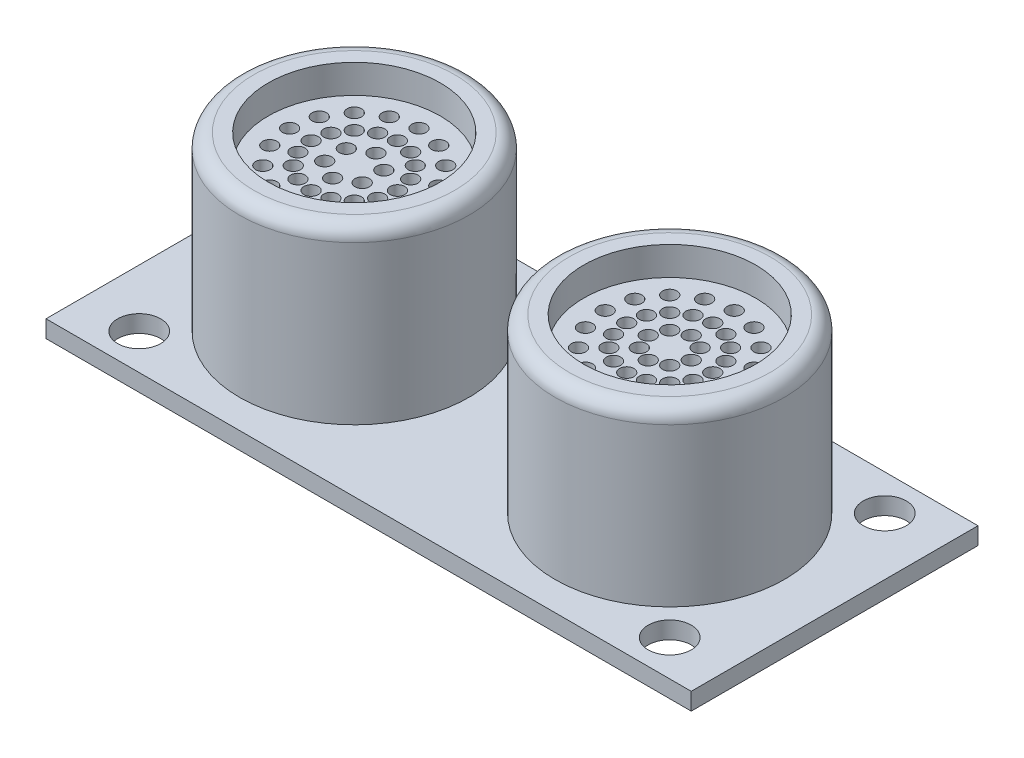
from build123d import *

# Parameters (mm, degrees)
SKETCH_1_W          = 45
SKETCH_1_H          = 20
EXTRUDE_1_DEPTH     = 1.2
SKETCH_2_R          = 8
SKETCH_2_R_2        = 6
EXTRUDE_2_DEPTH     = 12
FILLET_1_R          = 1
EXTRUDE_START       = -8
SKETCH_3_R          = 6
SKETCH_3_R_2        = 0.5
EXTRUDE_3_DEPTH     = 8
SKETCH_4_R          = 0.5
CUT_EXTRUDE_1_DEPTH = 8
SKETCH_5_R          = 1.5
CUT_EXTRUDE_2_DEPTH = 28.39069185


with BuildPart() as part:
    # 草图1 → 凸台-拉伸1 (new body)
    with BuildSketch(Plane(origin=(0, 0, 0), x_dir=(1, 0, 0), z_dir=(0, 1, 0))):
        Rectangle(SKETCH_1_W, SKETCH_1_H)
    extrude(amount=EXTRUDE_1_DEPTH)

    # 草图2 → 凸台-拉伸2 (add)
    # profile 1 of 2: a face of its own
    with BuildSketch(Plane(origin=(0, 1.2, 0), x_dir=(1, 0, 0), z_dir=(0, 1, 0))):
        with Locations(Location((-11, 0, 0), (0, 0, 270))):
            Circle(SKETCH_2_R)
        with Locations(Location((-11, 0, 0), (0, 0, 270))):
            Circle(SKETCH_2_R_2, mode=Mode.SUBTRACT)
    # profile 2 of 2: a face of its own
    with BuildSketch(Plane(origin=(0, 1.2, 0), x_dir=(1, 0, 0), z_dir=(0, 1, 0))):
        with Locations(Location((11, 0, 0), (0, 0, 270))):
            Circle(SKETCH_2_R)
        with Locations(Location((11, 0, 0), (0, 0, 270))):
            Circle(SKETCH_2_R_2, mode=Mode.SUBTRACT)
    extrude(amount=EXTRUDE_2_DEPTH)

    # 圆角1
    fillet_1_edges = [part.edges().sort_by_distance(p)[0] for p in [
        (-11, 13.2, -8),
        (11, 13.2, -8),
    ]]
    fillet(fillet_1_edges, radius=FILLET_1_R)

    # 草图3 → 凸台-拉伸3 (add)
    # profile 1 of 2: a face of its own
    with BuildSketch(Plane(origin=(0, 11.2, 0), x_dir=(1, 0, 0), z_dir=(0, 1, 0)).offset(EXTRUDE_START)):
        with Locations(Location((-11, 0, 0), (0, 0, 270))):
            Circle(SKETCH_3_R)
        with Locations(Location((-11, 4.509880422, 0), (0, 0, 270))):
            Circle(SKETCH_3_R_2, mode=Mode.SUBTRACT)
        with Locations(Location((-11, 3.009880422, 0), (0, 0, 270))):
            Circle(SKETCH_3_R_2, mode=Mode.SUBTRACT)
        with Locations(Location((-11, 1.509880422, 0), (0, 0, 270))):
            Circle(SKETCH_3_R_2, mode=Mode.SUBTRACT)
        with Locations(Location((-9.27414348, 4.166586216, 0), (0, 0, 270))):
            Circle(SKETCH_3_R_2, mode=Mode.SUBTRACT)
        with Locations(Location((-9.848168629, 2.780766918, 0), (0, 0, 270))):
            Circle(SKETCH_3_R_2, mode=Mode.SUBTRACT)
        with Locations(Location((-7.811032971, 3.188967029, 0), (0, 0, 270))):
            Circle(SKETCH_3_R_2, mode=Mode.SUBTRACT)
        with Locations(Location((-8.871693143, 2.128306857, 0), (0, 0, 270))):
            Circle(SKETCH_3_R_2, mode=Mode.SUBTRACT)
        with Locations(Location((-6.833413784, 1.72585652, 0), (0, 0, 270))):
            Circle(SKETCH_3_R_2, mode=Mode.SUBTRACT)
        with Locations(Location((-8.219233082, 1.151831371, 0), (0, 0, 270))):
            Circle(SKETCH_3_R_2, mode=Mode.SUBTRACT)
        with Locations(Location((-6.490119578, 0, 0), (0, 0, 270))):
            Circle(SKETCH_3_R_2, mode=Mode.SUBTRACT)
        with Locations(Location((-7.990119578, 0, 0), (0, 0, 270))):
            Circle(SKETCH_3_R_2, mode=Mode.SUBTRACT)
        with Locations(Location((-6.833413784, -1.72585652, 0), (0, 0, 270))):
            Circle(SKETCH_3_R_2, mode=Mode.SUBTRACT)
        with Locations(Location((-8.219233082, -1.151831371, 0), (0, 0, 270))):
            Circle(SKETCH_3_R_2, mode=Mode.SUBTRACT)
        with Locations(Location((-7.811032971, -3.188967029, 0), (0, 0, 270))):
            Circle(SKETCH_3_R_2, mode=Mode.SUBTRACT)
        with Locations(Location((-8.871693143, -2.128306857, 0), (0, 0, 270))):
            Circle(SKETCH_3_R_2, mode=Mode.SUBTRACT)
        with Locations(Location((-9.27414348, -4.166586216, 0), (0, 0, 270))):
            Circle(SKETCH_3_R_2, mode=Mode.SUBTRACT)
        with Locations(Location((-9.848168629, -2.780766918, 0), (0, 0, 270))):
            Circle(SKETCH_3_R_2, mode=Mode.SUBTRACT)
        with Locations(Location((-11, -4.509880422, 0), (0, 0, 270))):
            Circle(SKETCH_3_R_2, mode=Mode.SUBTRACT)
        with Locations(Location((-11, -3.009880422, 0), (0, 0, 270))):
            Circle(SKETCH_3_R_2, mode=Mode.SUBTRACT)
        with Locations(Location((-12.72585652, -4.166586216, 0), (0, 0, 270))):
            Circle(SKETCH_3_R_2, mode=Mode.SUBTRACT)
        with Locations(Location((-12.151831371, -2.780766918, 0), (0, 0, 270))):
            Circle(SKETCH_3_R_2, mode=Mode.SUBTRACT)
        with Locations(Location((-14.188967029, -3.188967029, 0), (0, 0, 270))):
            Circle(SKETCH_3_R_2, mode=Mode.SUBTRACT)
        with Locations(Location((-13.128306857, -2.128306857, 0), (0, 0, 270))):
            Circle(SKETCH_3_R_2, mode=Mode.SUBTRACT)
        with Locations(Location((-15.166586216, -1.72585652, 0), (0, 0, 270))):
            Circle(SKETCH_3_R_2, mode=Mode.SUBTRACT)
        with Locations(Location((-13.780766918, -1.151831371, 0), (0, 0, 270))):
            Circle(SKETCH_3_R_2, mode=Mode.SUBTRACT)
        with Locations(Location((-15.509880422, 0, 0), (0, 0, 270))):
            Circle(SKETCH_3_R_2, mode=Mode.SUBTRACT)
        with Locations(Location((-14.009880422, 0, 0), (0, 0, 270))):
            Circle(SKETCH_3_R_2, mode=Mode.SUBTRACT)
        with Locations(Location((-15.166586216, 1.72585652, 0), (0, 0, 270))):
            Circle(SKETCH_3_R_2, mode=Mode.SUBTRACT)
        with Locations(Location((-13.780766918, 1.151831371, 0), (0, 0, 270))):
            Circle(SKETCH_3_R_2, mode=Mode.SUBTRACT)
        with Locations(Location((-14.188967029, 3.188967029, 0), (0, 0, 270))):
            Circle(SKETCH_3_R_2, mode=Mode.SUBTRACT)
        with Locations(Location((-13.128306857, 2.128306857, 0), (0, 0, 270))):
            Circle(SKETCH_3_R_2, mode=Mode.SUBTRACT)
        with Locations(Location((-12.72585652, 4.166586216, 0), (0, 0, 270))):
            Circle(SKETCH_3_R_2, mode=Mode.SUBTRACT)
        with Locations(Location((-12.151831371, 2.780766918, 0), (0, 0, 270))):
            Circle(SKETCH_3_R_2, mode=Mode.SUBTRACT)
        with Locations(Location((-9.692405197, 0.754940211, 0), (0, 0, 270))):
            Circle(SKETCH_3_R_2, mode=Mode.SUBTRACT)
        with Locations(Location((-9.692405197, -0.754940211, 0), (0, 0, 270))):
            Circle(SKETCH_3_R_2, mode=Mode.SUBTRACT)
        with Locations(Location((-11, -1.509880422, 0), (0, 0, 270))):
            Circle(SKETCH_3_R_2, mode=Mode.SUBTRACT)
        with Locations(Location((-12.307594803, -0.754940211, 0), (0, 0, 270))):
            Circle(SKETCH_3_R_2, mode=Mode.SUBTRACT)
        with Locations(Location((-12.307594803, 0.754940211, 0), (0, 0, 270))):
            Circle(SKETCH_3_R_2, mode=Mode.SUBTRACT)
    # profile 2 of 2: a face of its own
    with BuildSketch(Plane(origin=(0, 11.2, 0), x_dir=(1, 0, 0), z_dir=(0, 1, 0)).offset(EXTRUDE_START)):
        with Locations(Location((11, 0, 0), (0, 0, 270))):
            Circle(SKETCH_3_R)
    extrude(amount=EXTRUDE_3_DEPTH)

    # 草图4 → 切除-拉伸1 (cut)
    with BuildSketch(Plane(origin=(0, 11.2, 0), x_dir=(1, 0, 0), z_dir=(0, 1, 0))):
        with Locations(Location((11, 1.5, 0), (0, 0, 270))):
            Circle(SKETCH_4_R)
        with Locations(Location((11, 3, 0), (0, 0, 270))):
            Circle(SKETCH_4_R)
        with Locations(Location((11, 4.5, 0), (0, 0, 270))):
            Circle(SKETCH_4_R)
        with Locations(Location((12.722075446, 4.157457896, 0), (0, 0, 270))):
            Circle(SKETCH_4_R)
        with Locations(Location((12.148050297, 2.771638598, 0), (0, 0, 270))):
            Circle(SKETCH_4_R)
        with Locations(Location((14.181980515, 3.181980515, 0), (0, 0, 270))):
            Circle(SKETCH_4_R)
        with Locations(Location((13.121320344, 2.121320344, 0), (0, 0, 270))):
            Circle(SKETCH_4_R)
        with Locations(Location((15.157457896, 1.722075446, 0), (0, 0, 270))):
            Circle(SKETCH_4_R)
        with Locations(Location((13.771638598, 1.148050297, 0), (0, 0, 270))):
            Circle(SKETCH_4_R)
        with Locations(Location((15.5, 0, 0), (0, 0, 270))):
            Circle(SKETCH_4_R)
        with Locations(Location((14, 0, 0), (0, 0, 270))):
            Circle(SKETCH_4_R)
        with Locations(Location((15.157457896, -1.722075446, 0), (0, 0, 270))):
            Circle(SKETCH_4_R)
        with Locations(Location((13.771638598, -1.148050297, 0), (0, 0, 270))):
            Circle(SKETCH_4_R)
        with Locations(Location((14.181980515, -3.181980515, 0), (0, 0, 270))):
            Circle(SKETCH_4_R)
        with Locations(Location((13.121320344, -2.121320344, 0), (0, 0, 270))):
            Circle(SKETCH_4_R)
        with Locations(Location((12.722075446, -4.157457896, 0), (0, 0, 270))):
            Circle(SKETCH_4_R)
        with Locations(Location((12.148050297, -2.771638598, 0), (0, 0, 270))):
            Circle(SKETCH_4_R)
        with Locations(Location((11, -4.5, 0), (0, 0, 270))):
            Circle(SKETCH_4_R)
        with Locations(Location((11, -3, 0), (0, 0, 270))):
            Circle(SKETCH_4_R)
        with Locations(Location((9.277924554, -4.157457896, 0), (0, 0, 270))):
            Circle(SKETCH_4_R)
        with Locations(Location((9.851949703, -2.771638598, 0), (0, 0, 270))):
            Circle(SKETCH_4_R)
        with Locations(Location((7.818019485, -3.181980515, 0), (0, 0, 270))):
            Circle(SKETCH_4_R)
        with Locations(Location((8.878679656, -2.121320344, 0), (0, 0, 270))):
            Circle(SKETCH_4_R)
        with Locations(Location((6.842542104, -1.722075446, 0), (0, 0, 270))):
            Circle(SKETCH_4_R)
        with Locations(Location((8.228361402, -1.148050297, 0), (0, 0, 270))):
            Circle(SKETCH_4_R)
        with Locations(Location((6.5, 0, 0), (0, 0, 270))):
            Circle(SKETCH_4_R)
        with Locations(Location((8, 0, 0), (0, 0, 270))):
            Circle(SKETCH_4_R)
        with Locations(Location((6.842542104, 1.722075446, 0), (0, 0, 270))):
            Circle(SKETCH_4_R)
        with Locations(Location((8.228361402, 1.148050297, 0), (0, 0, 270))):
            Circle(SKETCH_4_R)
        with Locations(Location((7.818019485, 3.181980515, 0), (0, 0, 270))):
            Circle(SKETCH_4_R)
        with Locations(Location((8.878679656, 2.121320344, 0), (0, 0, 270))):
            Circle(SKETCH_4_R)
        with Locations(Location((9.277924554, 4.157457896, 0), (0, 0, 270))):
            Circle(SKETCH_4_R)
        with Locations(Location((9.851949703, 2.771638598, 0), (0, 0, 270))):
            Circle(SKETCH_4_R)
        with Locations(Location((12.060660172, 1.060660172, 0), (0, 0, 270))):
            Circle(SKETCH_4_R)
        with Locations(Location((12.5, 0, 0), (0, 0, 270))):
            Circle(SKETCH_4_R)
        with Locations(Location((12.060660172, -1.060660172, 0), (0, 0, 270))):
            Circle(SKETCH_4_R)
        with Locations(Location((11, -1.5, 0), (0, 0, 270))):
            Circle(SKETCH_4_R)
        with Locations(Location((9.939339828, -1.060660172, 0), (0, 0, 270))):
            Circle(SKETCH_4_R)
        with Locations(Location((9.5, 0, 0), (0, 0, 270))):
            Circle(SKETCH_4_R)
        with Locations(Location((9.939339828, 1.060660172, 0), (0, 0, 270))):
            Circle(SKETCH_4_R)
    extrude(amount=-CUT_EXTRUDE_1_DEPTH, mode=Mode.SUBTRACT)

    # 草图5 → 切除-拉伸2 (cut, through all)
    with BuildSketch(Plane(origin=(0, 1.2, 0), x_dir=(1, 0, 0), z_dir=(0, 1, 0))):
        with Locations(Location((-18.5, 7.5, 0), (0, 0, 270))):
            Circle(SKETCH_5_R)
        with Locations(Location((-18.5, -7.5, 0), (0, 0, 90))):
            Circle(SKETCH_5_R)
        with Locations(Location((18.5, -7.5, 0), (0, 0, 270))):
            Circle(SKETCH_5_R)
        with Locations(Location((18.5, 7.5, 0), (0, 0, 90))):
            Circle(SKETCH_5_R)
    extrude(amount=-CUT_EXTRUDE_2_DEPTH, mode=Mode.SUBTRACT)


solid = part.part
